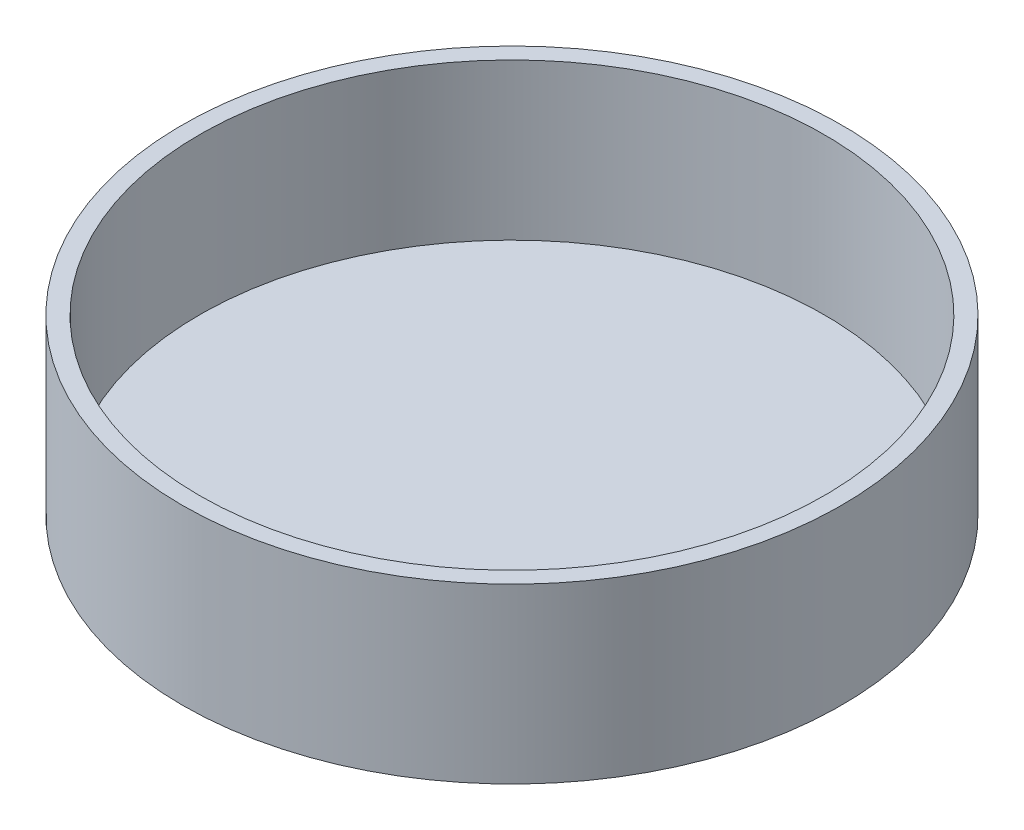
from build123d import *

# Parameters (mm, degrees)
SKETCH1_R           = 15.3416
BOSS_EXTRUDE1_DEPTH = 0.79375
SKETCH2_R           = 15.3416
SKETCH2_R_2         = 14.54785
BOSS_EXTRUDE2_DEPTH = 7.2644


with BuildPart() as part:
    # Sketch1 → Boss-Extrude1 (new body)
    with BuildSketch(Plane(origin=(0, 0, 0), x_dir=(1, 0, 0), z_dir=(0, 1, 0))):
        Circle(SKETCH1_R)
    extrude(amount=BOSS_EXTRUDE1_DEPTH)

    # Sketch2 → Boss-Extrude2 (add)
    with BuildSketch(Plane(origin=(0, 0.79375, 0), x_dir=(1, 0, 0), z_dir=(0, 1, 0))):
        Circle(SKETCH2_R)
        Circle(SKETCH2_R_2, mode=Mode.SUBTRACT)
    extrude(amount=BOSS_EXTRUDE2_DEPTH)


solid = part.part
